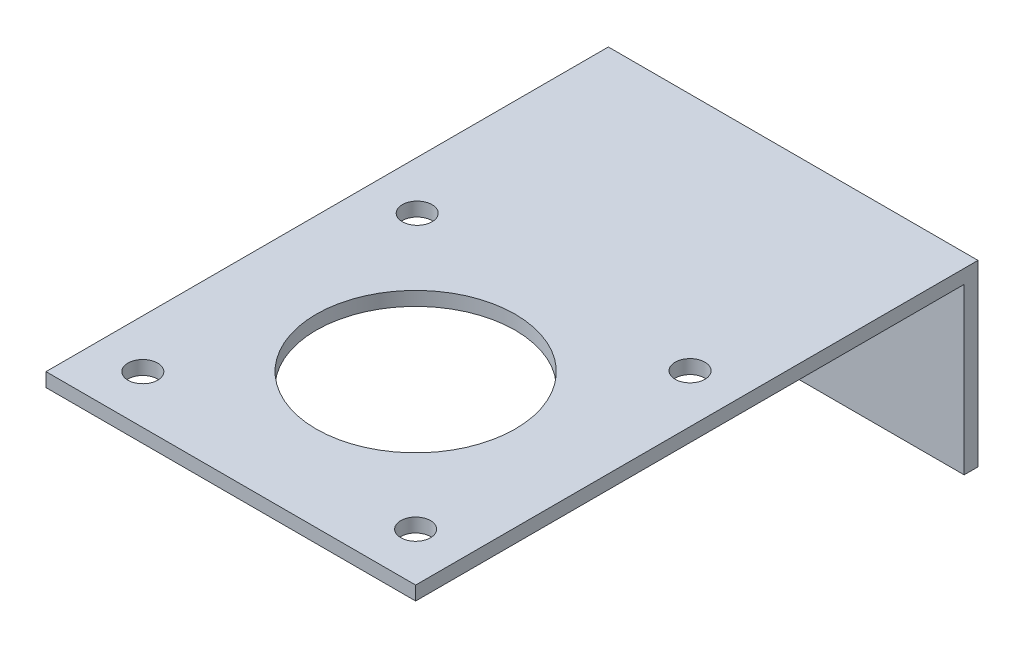
from build123d import *

# Parameters (mm, degrees)
SKETCH1_W           = 20.32
SKETCH1_H           = 42
BOSS_EXTRUDE1_DEPTH = 1.5748
SKETCH2_W           = 42
SKETCH2_H           = 1.5748
BOSS_EXTRUDE2_DEPTH = 62.32
SKETCH3_R           = 11.303
SKETCH3_R_2         = 1.6891
CUT_EXTRUDE1_DEPTH  = 62.32
SKETCH4_R           = 2.05
CUT_EXTRUDE2_DEPTH  = 62.32


with BuildPart() as part:
    # Sketch1 → Boss-Extrude1 (new body)
    with BuildSketch(Plane(origin=(0, 0, 0), x_dir=(0, 1, 0), z_dir=(0, 0, 1))):
        Rectangle(SKETCH1_W, SKETCH1_H)
    extrude(amount=BOSS_EXTRUDE1_DEPTH)

    # Sketch2 → Boss-Extrude2 (add)
    with BuildSketch(Plane.XY.offset(1.5748)):
        with Locations((0, 9.3726)):
            Rectangle(SKETCH2_W, SKETCH2_H)
    extrude(amount=BOSS_EXTRUDE2_DEPTH)

    # Sketch3 → Cut-Extrude1 (cut)
    with BuildSketch(Plane(origin=(0, 8.5852, 0), x_dir=(-1, 0, 0), z_dir=(0, -1, 0))):
        with Locations(Location((0, -42.8918, 0), (0, 0, 90))):
            Circle(SKETCH3_R)
        with Locations(Location((-15.5009, -58.3957, 0), (0, 0, 90))):
            Circle(SKETCH3_R_2)
        with Locations(Location((-15.5009, -27.2175, 0), (0, 0, 90))):
            Circle(SKETCH3_R_2)
        with Locations(Location((15.5009, -27.2175, 0), (0, 0, 180))):
            Circle(SKETCH3_R_2)
        with Locations(Location((15.5009, -58.3957, 0), (0, 0, 180))):
            Circle(SKETCH3_R_2)
    extrude(amount=-CUT_EXTRUDE1_DEPTH, mode=Mode.SUBTRACT)

    # Sketch4 → Cut-Extrude2 (cut)
    with BuildSketch(Plane.XY.offset(1.5748)):
        with Locations((9.035, 0)):
            Circle(SKETCH4_R)
        with Locations((-9.035, 0)):
            Circle(SKETCH4_R)
    extrude(amount=-CUT_EXTRUDE2_DEPTH, mode=Mode.SUBTRACT)


solid = part.part
